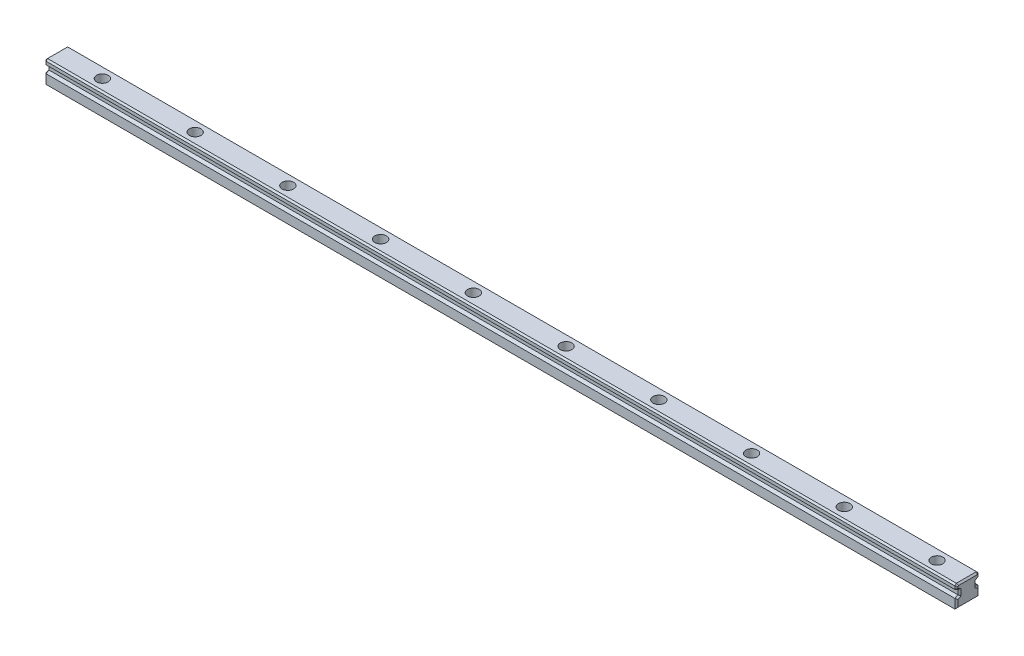
from build123d import *

# Parameters (mm, degrees)
BOSS_EXTRUDE1_DEPTH = 590
CHAMFER1_SIZE       = 1
CHAMFER2_SIZE       = 1
SKETCH2_R           = 3.75
CUT_EXTRUDE1_DEPTH  = 5.3
SKETCH3_R           = 2.25
CUT_EXTRUDE2_DEPTH  = 591.111802966
LPATTERN1_COUNT     = 67
LPATTERN1_PITCH     = 60


with BuildPart() as part:
    # Sketch1 → Boss-Extrude1 (new body)
    with BuildSketch(Plane(origin=(0, 0, 0), x_dir=(0, 0, -1), z_dir=(1, 0, 0))):
        Polygon((-7.5, 0), (7.5, 0), (7.5, 6), (5.5, 7), (5.5, 10), (7.5, 11), (7.5, 13), (6.5, 14), (-6.5, 14), (-7.5, 13), (-7.5, 11), (-5.5, 10), (-5.5, 7), (-7.5, 6), align=None)
    extrude(amount=BOSS_EXTRUDE1_DEPTH)

    # Chamfer1
    chamfer1_edges = [part.edges().sort_by_distance(p)[0] for p in [
        (0, 6.5, 6.5),
        (0, 8.5, 5.5),
        (0, 10.5, 6.5),
        (0, 12, 7.5),
        (0, 13.5, 7),
        (0, 14, 0),
        (0, 13.5, -7),
        (0, 12, -7.5),
        (0, 10.5, -6.5),
        (0, 8.5, -5.5),
        (0, 6.5, -6.5),
        (0, 3, -7.5),
        (0, 0, 0),
        (0, 3, 7.5),
    ]]
    chamfer(chamfer1_edges, length=CHAMFER1_SIZE)

    # Chamfer2
    chamfer2_edges = [part.edges().sort_by_distance(p)[0] for p in [
        (590, 3, -7.5),
        (590, 6.5, -6.5),
        (590, 8.5, -5.5),
        (590, 10.5, -6.5),
        (590, 12, -7.5),
        (590, 13.5, -7),
        (590, 14, 0),
        (590, 13.5, 7),
        (590, 12, 7.5),
        (590, 10.5, 6.5),
        (590, 3, 7.5),
        (590, 8.5, 5.5),
        (590, 6.5, 6.5),
        (590, 0, 0),
    ]]
    chamfer(chamfer2_edges, length=CHAMFER2_SIZE)

    # Sketch2 → Cut-Extrude1 (cut)
    with BuildSketch(Plane(origin=(0, 14, 0), x_dir=(1, 0, 0), z_dir=(0, 1, 0))):
        with Locations(Location((570, 0, 0), (0, 0, 270))):
            Circle(SKETCH2_R)
    cut_extrude1 = extrude(amount=-CUT_EXTRUDE1_DEPTH, mode=Mode.SUBTRACT)

    # Sketch3 → Cut-Extrude2 (cut, through all)
    with BuildSketch(Plane(origin=(0, 8.7, 0), x_dir=(1, 0, 0), z_dir=(0, 1, 0))):
        with Locations(Location((570, 0, 0), (0, 0, 270))):
            Circle(SKETCH3_R)
    cut_extrude2 = extrude(amount=-CUT_EXTRUDE2_DEPTH, mode=Mode.SUBTRACT)

    # LPattern1: Cut-Extrude1, Cut-Extrude2 ×67
    with Locations(*[(-i * LPATTERN1_PITCH, 0, 0) for i in range(1, LPATTERN1_COUNT)]):
        add(cut_extrude1, mode=Mode.SUBTRACT)
        add(cut_extrude2, mode=Mode.SUBTRACT)


solid = part.part
